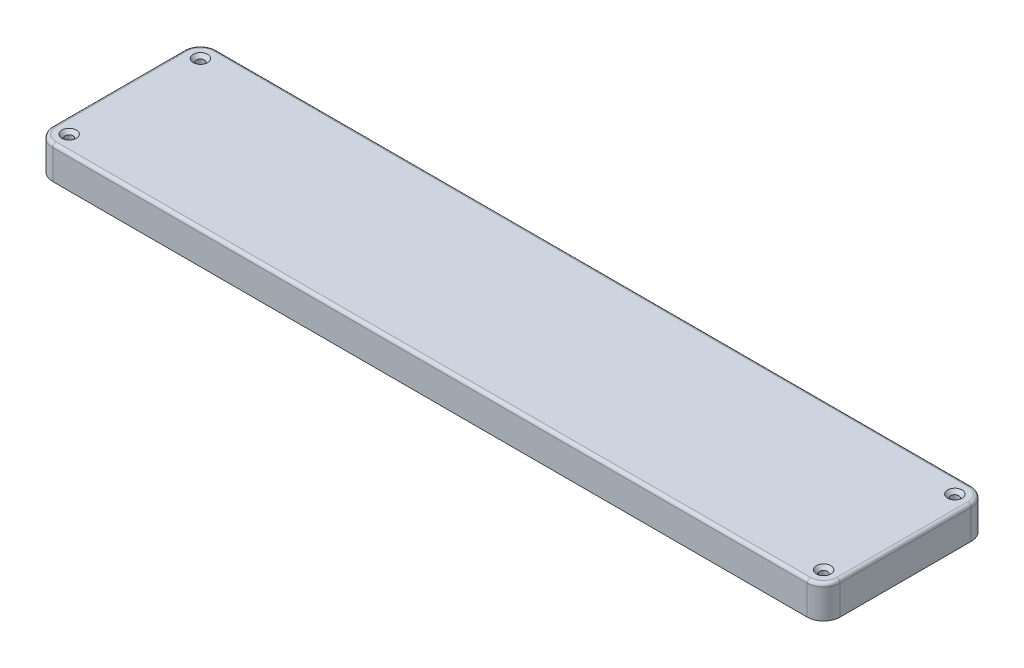
from build123d import *

# Parameters (mm, degrees)
BOSS_EXTRUDE1_DEPTH                                 = 10
CUT_EXTRUDE1_DEPTH                                  = 7
CSK_FOR_M2_COUNTERSUNK_FLAT_HEAD_SCREW2_D           = 2.4
CSK_FOR_M2_COUNTERSUNK_FLAT_HEAD_SCREW2_CSINK_D     = 4.4
CSK_FOR_M2_COUNTERSUNK_FLAT_HEAD_SCREW2_CSINK_ANGLE = 90
FILLET1_R                                           = 1


with BuildPart() as part:
    # Sketch1 → Boss-Extrude1 (new body)
    with BuildSketch(Plane(origin=(0, 0, 0), x_dir=(1, 0, 0), z_dir=(0, 1, 0))):
        with BuildLine():
            Line((-115, 25), (115, 25))
            ThreePointArc((115, 25), (118.535533906, 23.535533906), (120, 20))
            Line((120, 20), (120, -20))
            ThreePointArc((120, -20), (118.535533906, -23.535533906), (115, -25))
            Line((115, -25), (-115, -25))
            ThreePointArc((-115, -25), (-118.535533906, -23.535533906), (-120, -20))
            Line((-120, -20), (-120, 20))
            ThreePointArc((-120, 20), (-118.535533906, 23.535533906), (-115, 25))
        make_face()
    extrude(amount=-BOSS_EXTRUDE1_DEPTH)

    # Sketch2 → Cut-Extrude1 (cut)
    with BuildSketch(Plane.XZ.offset(10)):
        with BuildLine():
            ThreePointArc((110.125928985, 21.347074542), (111.23652041, 16.476032992), (115.978966674, 14.904516992))
            ThreePointArc((115.978966674, 14.904516992), (116.536912433, 15.216669336), (116.945654989, 14.725067791))
            Line((116.945654989, 14.725067791), (116.945654989, -14.725067791))
            ThreePointArc((116.945654989, -14.725067791), (116.58492435, -15.205280291), (116.023238809, -14.992583342))
            ThreePointArc((116.023238809, -14.992583342), (111.282334907, -16.506525423), (110.125928985, -21.347074542))
            ThreePointArc((110.125928985, -21.347074542), (110.043745309, -21.784949523), (109.644883292, -21.983438179))
            Line((109.644883292, -21.983438179), (-109.644883292, -21.983438179))
            ThreePointArc((-109.644883292, -21.983438179), (-110.043745309, -21.784949523), (-110.125928985, -21.347074542))
            ThreePointArc((-110.125928985, -21.347074542), (-111.42230579, -16.46889365), (-116.309291353, -15.206113484))
            ThreePointArc((-116.309291353, -15.206113484), (-116.747166334, -15.123929808), (-116.945654989, -14.725067791))
            Line((-116.945654989, -14.725067791), (-116.945654989, 14.725067791))
            ThreePointArc((-116.945654989, 14.725067791), (-116.746289712, 15.124590961), (-116.307179936, 15.205509941))
            ThreePointArc((-116.307179936, 15.205509941), (-111.411229141, 16.459961189), (-110.126182098, 21.347970622))
            ThreePointArc((-110.126182098, 21.347970622), (-110.043464387, 21.78532079), (-109.644883292, 21.983438179))
            Line((-109.644883292, 21.983438179), (109.644883292, 21.983438179))
            ThreePointArc((109.644883292, 21.983438179), (110.043745309, 21.784949523), (110.125928985, 21.347074542))
        make_face()
    extrude(amount=-CUT_EXTRUDE1_DEPTH, mode=Mode.SUBTRACT)

    # CSK for M2 Countersunk Flat Head Screw2 (through all)
    with Locations(Plane(origin=(-115, 0, -20), x_dir=(0, 0, 1), z_dir=(0, 1, 0))):
        with Locations((0, 0), (40, 0), (0, 230), (40, 230)):
            CounterSinkHole(CSK_FOR_M2_COUNTERSUNK_FLAT_HEAD_SCREW2_D / 2, CSK_FOR_M2_COUNTERSUNK_FLAT_HEAD_SCREW2_CSINK_D / 2, counter_sink_angle=CSK_FOR_M2_COUNTERSUNK_FLAT_HEAD_SCREW2_CSINK_ANGLE)

    # Fillet1
    fillet1_edges = [part.edges().sort_by_distance(p)[0] for p in [
        (-120, 0, 0),
        (-118.535533906, 0, -23.535533906),
        (0, 0, -25),
        (118.535533906, 0, -23.535533906),
        (120, 0, 0),
        (118.535533906, 0, 23.535533906),
        (0, 0, 25),
        (-118.535533906, 0, 23.535533906),
    ]]
    fillet(fillet1_edges, radius=FILLET1_R)


solid = part.part
